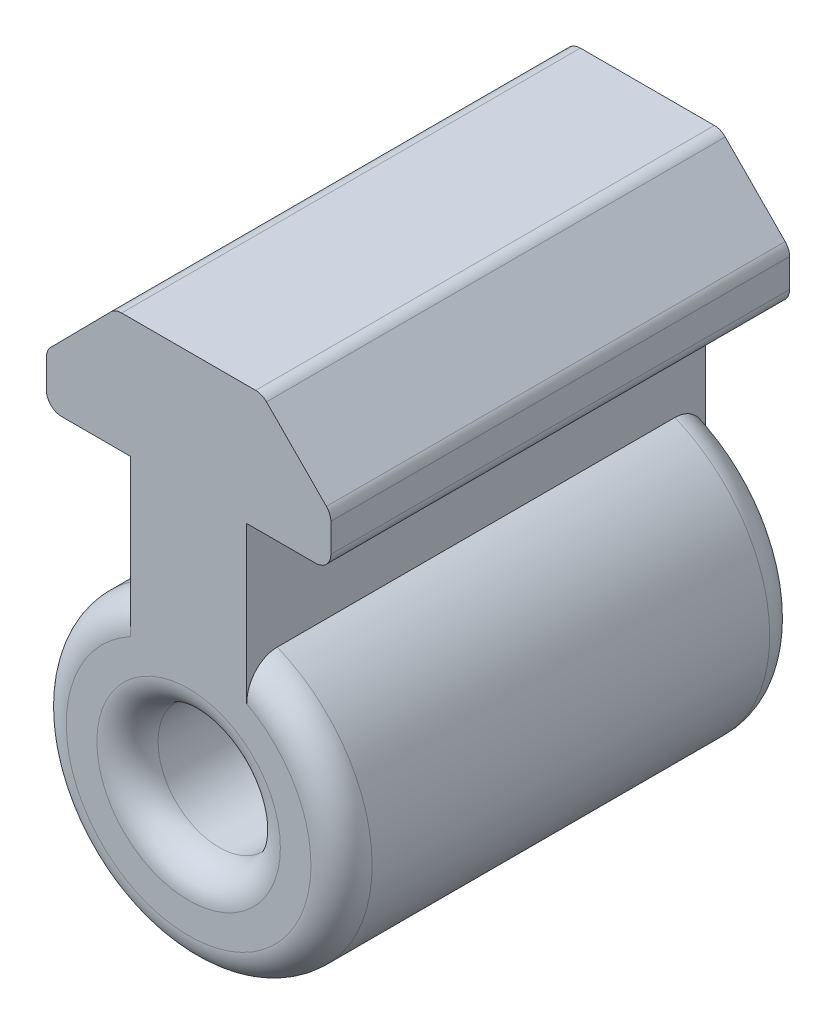
from build123d import *

# Parameters (mm, degrees)
BOSS_EXTRUDE1_DEPTH = 30
FILLET1_R           = 1
SKETCH3_R           = 10
SKETCH3_R_2         = 4
BOSS_EXTRUDE2_DEPTH = 30
FILLET2_R           = 2


with BuildPart() as part:
    # Sketch1 → Boss-Extrude1 (new body)
    with BuildSketch(Plane.XY):
        Polygon((3.8, 0), (-3.8, 0), (-3.8, 8), (-9.3, 8), (-9.3, 11.28), (-4.8, 15.830824101), (4.8, 15.830824101), (9.3, 11.28), (9.3, 8), (3.8, 8), align=None)
    extrude(amount=BOSS_EXTRUDE1_DEPTH)

    # Fillet1
    fillet1_edges = [part.edges().sort_by_distance(p)[0] for p in [
        (9.3, 11.28, 15),
        (9.3, 8, 15),
        (-9.3, 8, 15),
        (-9.3, 11.28, 15),
        (-4.8, 15.830824101, 15),
        (4.8, 15.830824101, 15),
    ]]
    fillet(fillet1_edges, radius=FILLET1_R)

    # Sketch3 → Boss-Extrude2 (add)
    with BuildSketch(Plane(origin=(0, 0, 0), x_dir=(-1, 0, 0), z_dir=(0, 0, -1))):
        with Locations((0, -9.249864864)):
            Circle(SKETCH3_R)
        with Locations((0, -9.249864864)):
            Circle(SKETCH3_R_2, mode=Mode.SUBTRACT)
    extrude(amount=-BOSS_EXTRUDE2_DEPTH)

    # Fillet2
    fillet2_edges = [part.edges().sort_by_distance(p)[0] for p in [
        (0, -19.249864864, 0),
        (0, -19.249864864, 30),
        (4, -9.249864864, 30),
        (4, -9.249864864, 0),
    ]]
    fillet(fillet2_edges, radius=FILLET2_R)


solid = part.part
